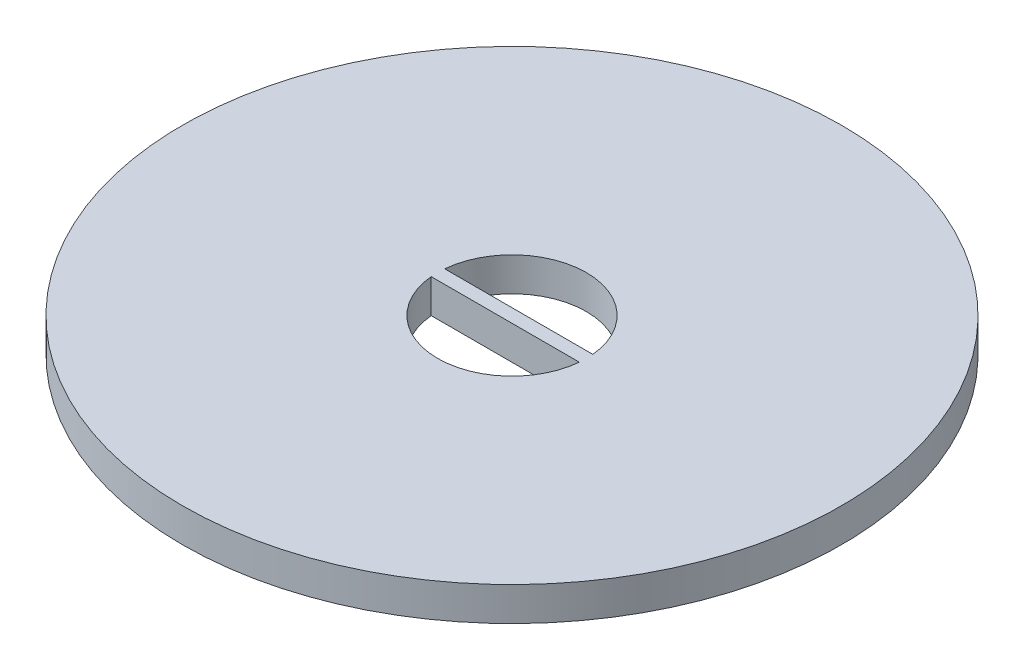
from build123d import *

# Parameters (mm, degrees)
SKETCH1_R           = 9.75
BOSS_EXTRUDE1_DEPTH = 1
CUT_EXTRUDE1_DEPTH  = 3


with BuildPart() as part:
    # Sketch1 → Boss-Extrude1 (new body)
    with BuildSketch(Plane(origin=(0, 0, 0), x_dir=(1, 0, 0), z_dir=(0, 1, 0))):
        with Locations(Location((0, 0, 0), (0, 0, 270))):
            Circle(SKETCH1_R)
    extrude(amount=BOSS_EXTRUDE1_DEPTH)

    # Sketch2 → Cut-Extrude1 (cut)
    with BuildSketch(Plane(origin=(0, 1, 0), x_dir=(1, 0, 0), z_dir=(0, 1, 0))):
        with BuildLine():
            Line((-2.19089023, 0.2), (0, 0.2))
            Line((0, 0.2), (2.19089023, 0.2))
            ThreePointArc((2.19089023, 0.2), (0, 2.2), (-2.19089023, 0.2))
        make_face()
        with BuildLine():
            Line((2.19089023, -0.2), (-2.19089023, -0.2))
            ThreePointArc((-2.19089023, -0.2), (0, -2.2), (2.19089023, -0.2))
        make_face()
    extrude(amount=-CUT_EXTRUDE1_DEPTH, mode=Mode.SUBTRACT)


solid = part.part
